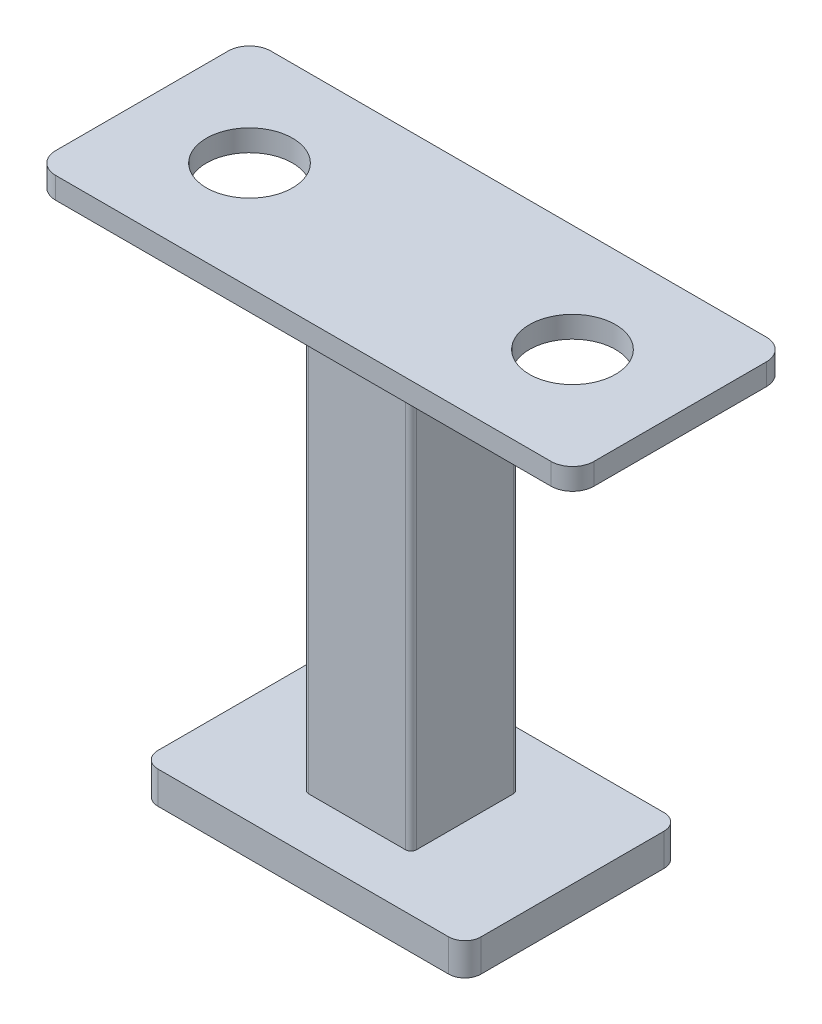
from build123d import *

# Parameters (mm, degrees)
BOSS_EXTRUDE1_DEPTH = 3
BOSS_EXTRUDE2_DEPTH = 41
BOSS_EXTRUDE3_DEPTH = 2
SKETCH5_R           = 4
CUT_EXTRUDE1_DEPTH  = 10


with BuildPart() as part:
    # Sketch1 → Boss-Extrude1 (new body)
    with BuildSketch(Plane(origin=(0, 0, 0), x_dir=(1, 0, 0), z_dir=(0, 1, 0))):
        with BuildLine():
            Line((1.5, 0), (28.5, 0))
            ThreePointArc((28.5, 0), (29.560660172, 0.439339828), (30, 1.5))
            Line((30, 1.5), (30, 18.5))
            ThreePointArc((30, 18.5), (29.560660172, 19.560660172), (28.5, 20))
            Line((28.5, 20), (1.5, 20))
            ThreePointArc((1.5, 20), (0.439339828, 19.560660172), (0, 18.5))
            Line((0, 18.5), (0, 1.5))
            ThreePointArc((0, 1.5), (0.439339828, 0.439339828), (1.5, 0))
        make_face()
    extrude(amount=BOSS_EXTRUDE1_DEPTH)

    # Sketch3 → Boss-Extrude2 (add)
    with BuildSketch(Plane(origin=(0, 3, 0), x_dir=(1, 0, 0), z_dir=(0, 1, 0))):
        with BuildLine():
            Line((10.5, 5), (19.5, 5))
            ThreePointArc((19.5, 5), (19.853553391, 5.146446609), (20, 5.5))
            Line((20, 5.5), (20, 14.5))
            ThreePointArc((20, 14.5), (19.853553391, 14.853553391), (19.5, 15))
            Line((19.5, 15), (10.5, 15))
            ThreePointArc((10.5, 15), (10.146446609, 14.853553391), (10, 14.5))
            Line((10, 14.5), (10, 5.5))
            ThreePointArc((10, 5.5), (10.146446609, 5.146446609), (10.5, 5))
        make_face()
    extrude(amount=BOSS_EXTRUDE2_DEPTH)

    # Sketch4 → Boss-Extrude3 (add)
    with BuildSketch(Plane(origin=(0, 44, 0), x_dir=(1, 0, 0), z_dir=(0, 1, 0))):
        with BuildLine():
            Line((-8, 20), (38, 20))
            ThreePointArc((38, 20), (39.414213562, 19.414213562), (40, 18))
            Line((40, 18), (40, 2))
            ThreePointArc((40, 2), (39.414213562, 0.585786438), (38, 0))
            Line((38, 0), (-8, 0))
            ThreePointArc((-8, 0), (-9.414213562, 0.585786438), (-10, 2))
            Line((-10, 2), (-10, 18))
            ThreePointArc((-10, 18), (-9.414213562, 19.414213562), (-8, 20))
        make_face()
    extrude(amount=BOSS_EXTRUDE3_DEPTH)

    # Sketch5 → Cut-Extrude1 (cut)
    with BuildSketch(Plane(origin=(0, 46, 0), x_dir=(1, 0, 0), z_dir=(0, 1, 0))):
        with Locations(Location((0, 10, 0), (0, 0, 270))):
            Circle(SKETCH5_R)
        with Locations(Location((30, 10, 0), (0, 0, 270))):
            Circle(SKETCH5_R)
    extrude(amount=-CUT_EXTRUDE1_DEPTH, mode=Mode.SUBTRACT)


solid = part.part
